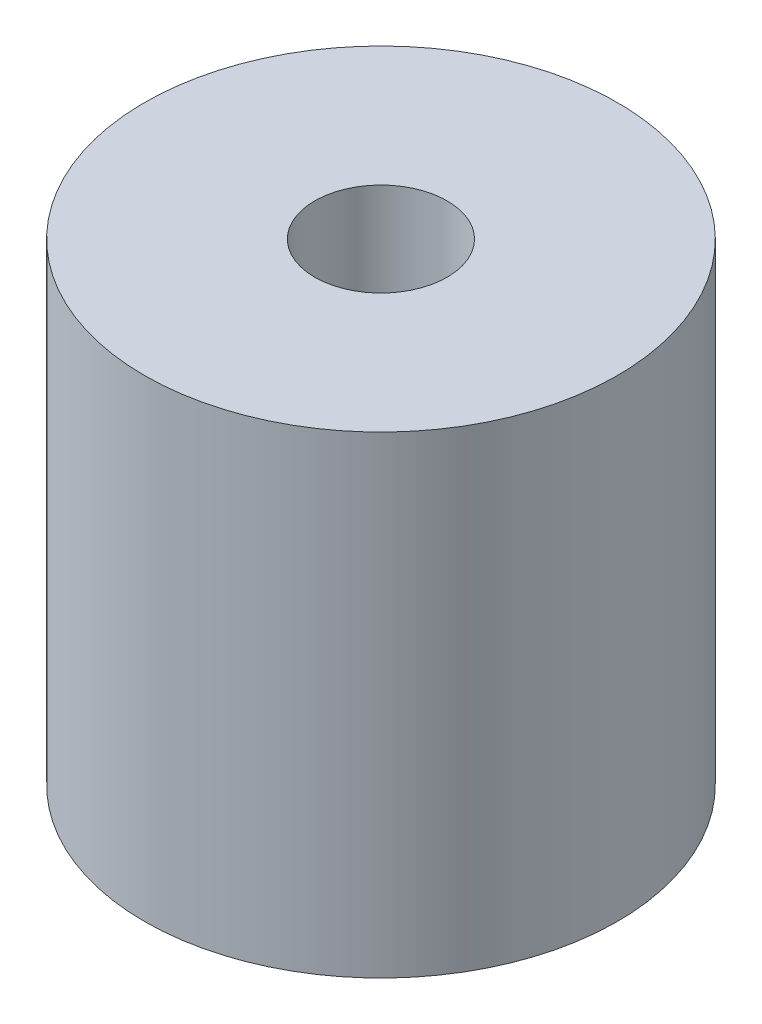
from build123d import *

# Parameters (mm, degrees)
SKETCH1_R           = 3.175
SKETCH1_R_2         = 0.889
BOSS_EXTRUDE1_DEPTH = 6.35


with BuildPart() as part:
    # Sketch1 → Boss-Extrude1 (new body)
    with BuildSketch(Plane(origin=(0, 0, 0), x_dir=(1, 0, 0), z_dir=(0, 1, 0))):
        with Locations(Location((0, 0, 0), (0, 0, 270))):
            Circle(SKETCH1_R)
        with Locations(Location((0, 0, 0), (0, 0, 270))):
            Circle(SKETCH1_R_2, mode=Mode.SUBTRACT)
    extrude(amount=BOSS_EXTRUDE1_DEPTH)


solid = part.part
